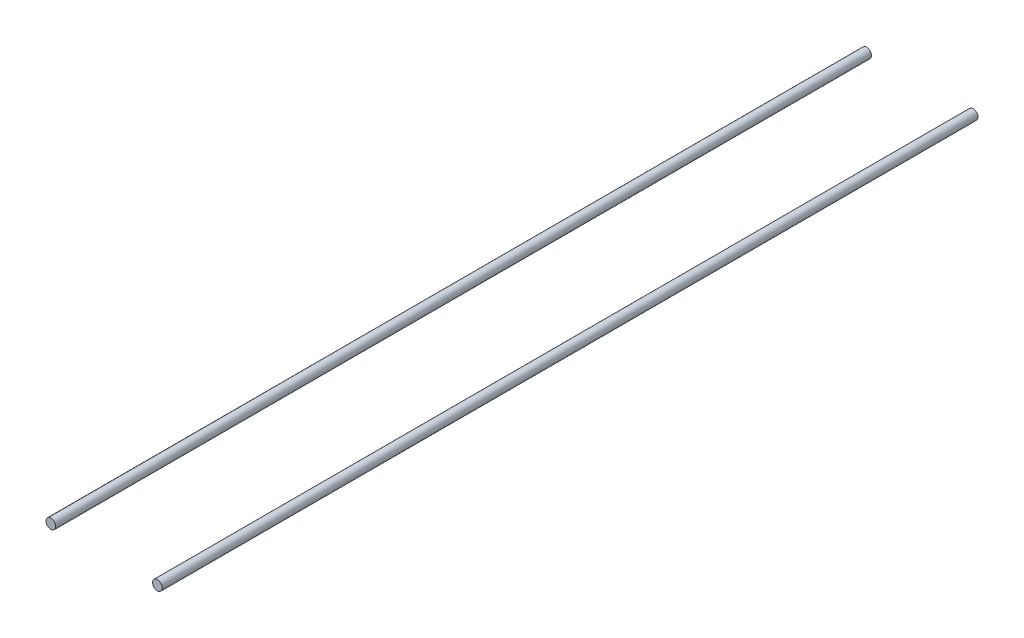
from build123d import *

# Parameters (mm, degrees)
BOSS_EXTRUDE2_DEPTH        = 100
BOSS_EXTRUDE2_DEPTH_BACK   = 903.2
SKETCH1_R                  = 6
BOSS_EXTRUDE2_2_DEPTH      = 100
BOSS_EXTRUDE2_2_DEPTH_BACK = 903.2


with BuildPart() as part:
    # Sketch1 → Boss-Extrude2 (new, two sides: drawn at the far end of the back side and taken through both)
    with BuildSketch(Plane(origin=(0, 0, 200), x_dir=(-1, 0, 0), z_dir=(0, 0, -1)).offset(-BOSS_EXTRUDE2_DEPTH_BACK)):
        with Locations(Location((-65.5, -30.887752409, 0), (0, 0, 90))):
            Circle(SKETCH1_R)
    extrude(amount=BOSS_EXTRUDE2_DEPTH + BOSS_EXTRUDE2_DEPTH_BACK)


with BuildPart() as body_2:
    # Sketch1 → Boss-Extrude2 2 (new, two sides: drawn at the far end of the back side and taken through both)
    with BuildSketch(Plane(origin=(0, 0, 200), x_dir=(-1, 0, 0), z_dir=(0, 0, -1)).offset(-BOSS_EXTRUDE2_2_DEPTH_BACK)):
        with Locations(Location((65.5, -30.887752409, 0), (0, 0, 270))):
            Circle(SKETCH1_R)
    extrude(amount=BOSS_EXTRUDE2_2_DEPTH + BOSS_EXTRUDE2_2_DEPTH_BACK)


solid = Compound([part.part, body_2.part])
